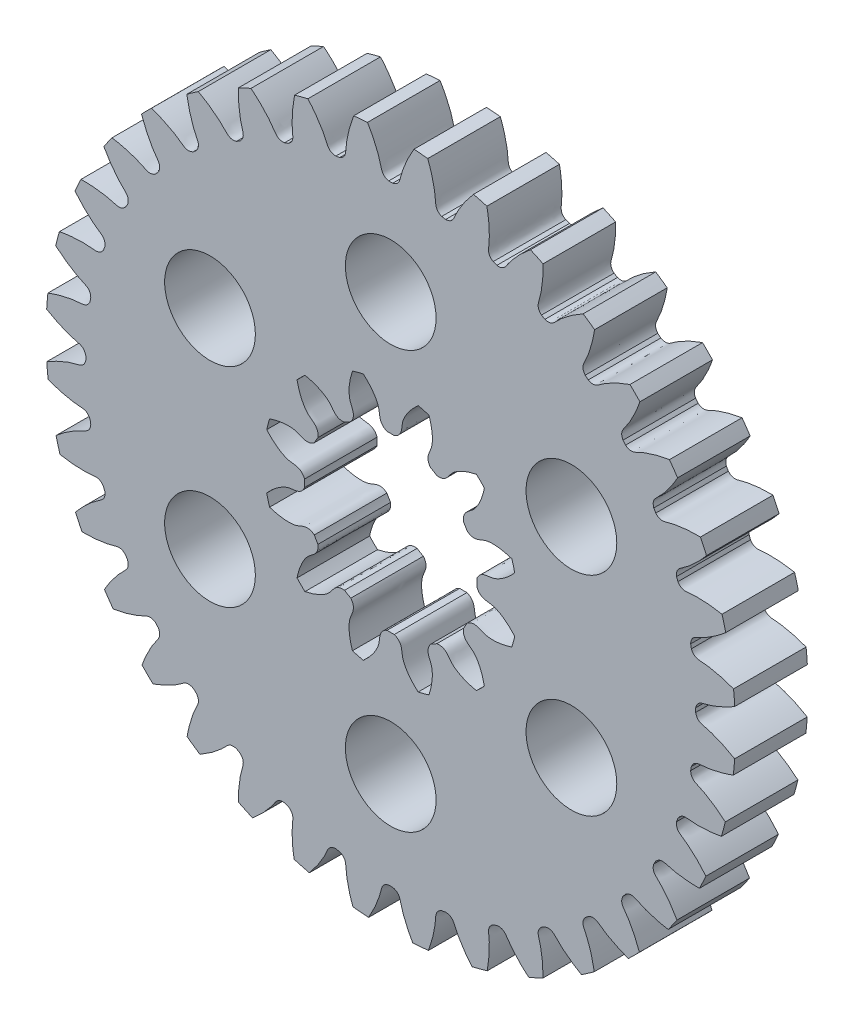
from build123d import *

# Parameters (mm, degrees)
SKETCH_1_R      = 2.5
EXTRUDE_1_DEPTH = 4


with BuildPart() as part:
    # 草图1 → 凸台-拉伸1 (new body)
    with BuildSketch(Plane.XY):
        with BuildLine():
            ThreePointArc((-261.765948352, -219.387318903), (-261.874210715, -219.406042582), (-261.982347935, -219.425475988))
            add(Edge.make_bspline(
                [(-261.982347935, -219.425475988), (-262.350990677, -219.408468774), (-262.42813317, -219.149706563), (-262.551765447, -218.883005482), (-262.588533375, -218.807284577), (-262.645775139, -218.695309688), (-262.729776471, -218.54276764), (-262.848292752, -218.346505921), (-262.989442171, -218.132528242), (-263.154809572, -217.902368775), (-263.332787518, -217.674435865), (-263.458064125, -217.525385086), (-263.517844577, -217.456499109)],
                knots=[0, 0, 0, 0, 0.120371484, 0.133302531, 0.147363917, 0.16255564, 0.196330101, 0.234625915, 0.277443082, 0.324781601, 0.376641473, 0.422355164, 0.422355164, 0.422355164, 0.422355164], degree=3))
            ThreePointArc((-263.517844577, -217.456499109), (-263.887514071, -217.551880751), (-264.255192484, -217.654670714))
            add(Edge.make_bspline(
                [(-264.600360766, -220.126970498), (-264.289610394, -219.927920447), (-264.352184141, -219.665254553), (-264.378465988, -219.372468503), (-264.384484482, -219.288508311), (-264.390899104, -219.162914331), (-264.39442284, -218.988808376), (-264.38991559, -218.759582601), (-264.374665447, -218.503697786), (-264.34653281, -218.22169014), (-264.306395676, -217.935518192), (-264.272473431, -217.74400839), (-264.255192484, -217.654670714)],
                knots=[0, 0, 0, 0, 0.120371484, 0.133302531, 0.147363917, 0.16255564, 0.196330101, 0.234625915, 0.277443082, 0.324781601, 0.376641473, 0.422247529, 0.422247529, 0.422247529, 0.422247529], degree=3))
            ThreePointArc((-264.600360766, -220.126970498), (-264.703727048, -220.164209284), (-264.806846845, -220.202125284))
            add(Edge.make_bspline(
                [(-264.806846845, -220.202125284), (-265.172842347, -220.249390588), (-265.293746459, -220.00795521), (-265.461812641, -219.766774438), (-265.511170778, -219.698588587), (-265.586987146, -219.598254776), (-265.696200959, -219.462616862), (-265.846997201, -219.289916936), (-266.023159077, -219.103700398), (-266.225980947, -218.905753319), (-266.439969032, -218.712969057), (-266.588303961, -218.58865378), (-266.65821002, -218.53190108)],
                knots=[0, 0, 0, 0, 0.120371484, 0.133302531, 0.147363917, 0.16255564, 0.196330101, 0.234625915, 0.277443082, 0.324781601, 0.376641473, 0.421771001, 0.421771001, 0.421771001, 0.421771001], degree=3))
            ThreePointArc((-266.65821002, -218.53190108), (-267.007105465, -218.690849751), (-267.352722655, -218.856805977))
            add(Edge.make_bspline(
                [(-267.263272935, -221.347575673), (-266.991808238, -221.097588404), (-267.099042803, -220.849778812), (-267.175767134, -220.566004635), (-267.196273727, -220.484365088), (-267.224400063, -220.36179305), (-267.258103448, -220.190944046), (-267.293469311, -219.96441805), (-267.322884783, -219.70977254), (-267.344149658, -219.427164043), (-267.354269692, -219.139672291), (-267.354165644, -218.946485167), (-267.352722655, -218.856805977)],
                knots=[0, 0, 0, 0, 0.120371484, 0.133302531, 0.147363917, 0.16255564, 0.196330101, 0.234625915, 0.277443082, 0.324781601, 0.376641473, 0.421594522, 0.421594522, 0.421594522, 0.421594522], degree=3))
            ThreePointArc((-267.263272935, -221.347575673), (-267.358602404, -221.402198085), (-267.453571535, -221.457444621))
            add(Edge.make_bspline(
                [(-267.453571535, -221.457444621), (-267.805799209, -221.567546311), (-267.966791329, -221.350773657), (-268.17418481, -221.142441349), (-268.234633435, -221.083862345), (-268.326720766, -220.998218204), (-268.457828651, -220.883605715), (-268.636322987, -220.739714981), (-268.842144731, -220.58691768), (-269.076258431, -220.427197509), (-269.318997214, -220.275422958), (-269.485127188, -220.179570299), (-269.562280178, -220.13661733)],
                knots=[0, 0, 0, 0, 0.120371484, 0.133302531, 0.147363917, 0.16255564, 0.196330101, 0.234625915, 0.277443082, 0.324781601, 0.376641473, 0.420899304, 0.420899304, 0.420899304, 0.420899304], degree=3))
            ThreePointArc((-269.562280178, -220.13661733), (-269.880139706, -220.355196294), (-270.193496095, -220.580183442))
            add(Edge.make_bspline(
                [(-269.673773621, -223.012046959), (-269.449842916, -222.718718208), (-269.598480031, -222.493294487), (-269.723315616, -222.227154518), (-269.757687226, -222.150316192), (-269.806670671, -222.034490385), (-269.869529644, -221.872089493), (-269.943694046, -221.655146153), (-270.016881361, -221.409477224), (-270.086897625, -221.134854792), (-270.146397398, -220.855315278), (-270.179582973, -220.666897328), (-270.193496095, -220.580183442)],
                knots=[0, 0, 0, 0, 0.120371484, 0.133302531, 0.147363917, 0.16255564, 0.196330101, 0.234625915, 0.277443082, 0.324781601, 0.376641473, 0.420658365, 0.420658365, 0.420658365, 0.420658365], degree=3))
            ThreePointArc((-269.673773621, -223.012046959), (-269.758169739, -223.082393322), (-269.842102615, -223.153291756))
            add(Edge.make_bspline(
                [(-269.842102615, -223.153291756), (-270.169860201, -223.322884447), (-270.366048665, -223.137361045), (-270.606467899, -222.968207273), (-270.676170311, -222.921015009), (-270.781730577, -222.852662792), (-270.930748889, -222.76255817), (-271.131517858, -222.651848676), (-271.360745681, -222.537113279), (-271.619037784, -222.420473035), (-271.882349489, -222.314002425), (-272.060448787, -222.249152344), (-272.141731615, -222.220924943)],
                knots=[0, 0, 0, 0, 0.120371484, 0.133302531, 0.147363917, 0.16255564, 0.196330101, 0.234625915, 0.277443082, 0.324781601, 0.376641473, 0.419767084, 0.419767084, 0.419767084, 0.419767084], degree=3))
            ThreePointArc((-272.141731615, -222.220924943), (-272.418884432, -222.493592174), (-272.690399964, -222.771873362))
            add(Edge.make_bspline(
                [(-271.758620979, -225.069810237), (-271.589028288, -224.74205265), (-271.774551689, -224.545864186), (-271.943705462, -224.305444953), (-271.990897726, -224.235742541), (-272.059249942, -224.130182275), (-272.149354565, -223.981163963), (-272.260064059, -223.780394993), (-272.374799455, -223.551167171), (-272.4914397, -223.292875068), (-272.59768643, -223.030117038), (-272.662351669, -222.852586298), (-272.690399964, -222.771873362)],
                knots=[0, 0, 0, 0, 0.120371484, 0.133302531, 0.147363917, 0.16255564, 0.196330101, 0.234625915, 0.277443082, 0.324781601, 0.376641473, 0.419467813, 0.419467813, 0.419467813, 0.419467813], degree=3))
            ThreePointArc((-271.758620979, -225.069810237), (-271.829519412, -225.153743113), (-271.899865776, -225.238139231))
            add(Edge.make_bspline(
                [(-271.899865776, -225.238139231), (-272.193194526, -225.462069936), (-272.418618247, -225.313432821), (-272.684758217, -225.188597236), (-272.761596543, -225.154225625), (-272.877422349, -225.10524218), (-273.039823242, -225.042383208), (-273.256766581, -224.968218806), (-273.50243551, -224.895031491), (-273.777057942, -224.825015227), (-274.052207447, -224.766449864), (-274.236176243, -224.733890621), (-274.318438603, -224.720559875)],
                knots=[0, 0, 0, 0, 0.120371484, 0.133302531, 0.147363917, 0.16255564, 0.196330101, 0.234625915, 0.277443082, 0.324781601, 0.376641473, 0.418409251, 0.418409251, 0.418409251, 0.418409251], degree=3))
            ThreePointArc((-274.318438603, -224.720559875), (-274.546050295, -225.040201895), (-274.767012342, -225.364476282))
            add(Edge.make_bspline(
                [(-273.454467978, -227.458341411), (-273.344366288, -227.106113737), (-273.561138942, -226.945121618), (-273.76947125, -226.737728137), (-273.828050255, -226.677279512), (-273.913694395, -226.585192181), (-274.028306884, -226.454084295), (-274.172197618, -226.27558996), (-274.324994919, -226.069768216), (-274.48471509, -225.835654516), (-274.633485149, -225.597720931), (-274.726673112, -225.436599256), (-274.767012342, -225.364476282)],
                knots=[0, 0, 0, 0, 0.120371484, 0.133302531, 0.147363917, 0.16255564, 0.196330101, 0.234625915, 0.277443082, 0.324781601, 0.376641473, 0.418059479, 0.418059479, 0.418059479, 0.418059479], degree=3))
            ThreePointArc((-273.454467978, -227.458341411), (-273.509714514, -227.553310542), (-273.564336926, -227.648640011))
            add(Edge.make_bspline(
                [(-273.564336926, -227.648640011), (-273.814324195, -227.920104709), (-274.062133787, -227.812870144), (-274.345907964, -227.736145813), (-274.427547511, -227.715639219), (-274.550119549, -227.687512883), (-274.720968553, -227.653809499), (-274.947494549, -227.618443636), (-275.202140059, -227.589028163), (-275.484748556, -227.567763288), (-275.762812848, -227.557975112), (-275.94656256, -227.557753873), (-276.026815335, -227.558781498)],
                knots=[0, 0, 0, 0, 0.120371484, 0.133302531, 0.147363917, 0.16255564, 0.196330101, 0.234625915, 0.277443082, 0.324781601, 0.376641473, 0.416867492, 0.416867492, 0.416867492, 0.416867492], degree=3))
            ThreePointArc((-276.026815335, -227.558781498), (-276.197157445, -227.916787157), (-276.359992523, -228.278269138))
            add(Edge.make_bspline(
                [(-274.709787165, -230.105066171), (-274.662521861, -229.739070669), (-274.903957239, -229.618166558), (-275.145138011, -229.450100376), (-275.213323863, -229.400742239), (-275.313657673, -229.32492587), (-275.449295587, -229.215712058), (-275.621995513, -229.064915816), (-275.808212051, -228.88875394), (-276.00615913, -228.685932069), (-276.191871553, -228.479793636), (-276.309671012, -228.339789451), (-276.359992523, -228.278269138)],
                knots=[0, 0, 0, 0, 0.120371484, 0.133302531, 0.147363917, 0.16255564, 0.196330101, 0.234625915, 0.277443082, 0.324781601, 0.376641473, 0.416476669, 0.416476669, 0.416476669, 0.416476669], degree=3))
            ThreePointArc((-274.709787165, -230.105066171), (-274.747703165, -230.208185968), (-274.784941952, -230.311552251))
            add(Edge.make_bspline(
                [(-274.784941952, -230.311552251), (-274.983992002, -230.622302623), (-275.246657896, -230.559728876), (-275.539443946, -230.533447028), (-275.623404138, -230.527428535), (-275.748998118, -230.521013912), (-275.923104073, -230.517490176), (-276.152329848, -230.521997427), (-276.408214664, -230.53724757), (-276.690222309, -230.565380207), (-276.962444646, -230.603560833), (-277.140159746, -230.634562871), (-277.215741141, -230.648798355)],
                knots=[0, 0, 0, 0, 0.120371484, 0.133302531, 0.147363917, 0.16255564, 0.196330101, 0.234625915, 0.277443082, 0.324781601, 0.376641473, 0.415188955, 0.415188955, 0.415188955, 0.415188955], degree=3))
            ThreePointArc((-277.215741141, -230.648798355), (-277.322476069, -231.03518804), (-277.421035671, -231.423743491))
            add(Edge.make_bspline(
                [(-275.486436301, -232.929565124), (-275.503443515, -232.560922382), (-275.762205726, -232.48377989), (-276.028906807, -232.360147612), (-276.104627712, -232.323379685), (-276.216602601, -232.266137921), (-276.369144649, -232.182136588), (-276.565406368, -232.063620307), (-276.779384047, -231.922470888), (-277.009543514, -231.757103487), (-277.225542548, -231.588443926), (-277.363320485, -231.473298186), (-277.421035671, -231.423743491)],
                knots=[0, 0, 0, 0, 0.120371484, 0.133302531, 0.147363917, 0.16255564, 0.196330101, 0.234625915, 0.277443082, 0.324781601, 0.376641473, 0.414768007, 0.414768007, 0.414768007, 0.414768007], degree=3))
            ThreePointArc((-275.486436301, -232.929565124), (-275.505869707, -233.037702344), (-275.524593386, -233.145964708))
            add(Edge.make_bspline(
                [(-275.524593386, -233.145964708), (-275.666658183, -233.486558762), (-275.93619941, -233.470547105), (-276.229101177, -233.495506302), (-276.312830925, -233.504158777), (-276.437630738, -233.519650773), (-276.609703523, -233.546413752), (-276.834664167, -233.590657165), (-277.084013358, -233.650109556), (-277.356851492, -233.726784909), (-277.614959564, -233.810569409), (-277.781318921, -233.870653679), (-277.850018611, -233.896470418)],
                knots=[0, 0, 0, 0, 0.120371484, 0.133302531, 0.147363917, 0.16255564, 0.196330101, 0.234625915, 0.277443082, 0.324781601, 0.376641473, 0.413424779, 0.413424779, 0.413424779, 0.413424779], degree=3))
            ThreePointArc((-277.850018611, -233.896470418), (-277.888484318, -234.300092941), (-277.918328637, -234.704444358))
            add(Edge.make_bspline(
                [(-275.760817296, -235.846017298), (-275.841580272, -235.48592834), (-276.109806957, -235.454891401), (-276.393924769, -235.379449533), (-276.474879987, -235.35638899), (-276.595093654, -235.319461092), (-276.759904924, -235.263224577), (-276.973765123, -235.180589315), (-277.209002339, -235.078741107), (-277.464380915, -234.95585278), (-277.703245273, -234.82893213), (-277.855898098, -234.741333561), (-277.918328637, -234.704444358)],
                knots=[0, 0, 0, 0, 0.120371484, 0.133302531, 0.147363917, 0.16255564, 0.196330101, 0.234625915, 0.277443082, 0.324781601, 0.376641473, 0.412985889, 0.412985889, 0.412985889, 0.412985889], degree=3))
            ThreePointArc((-275.760817296, -235.846017298), (-275.761177634, -235.955886246), (-275.760817296, -236.065755195))
            add(Edge.make_bspline(
                [(-275.760817296, -236.065755195), (-275.841580272, -236.425844153), (-276.109806957, -236.456881092), (-276.393924769, -236.53232296), (-276.474879987, -236.555383503), (-276.595093654, -236.592311401), (-276.759904924, -236.648547916), (-276.973765123, -236.731183178), (-277.209002339, -236.833031386), (-277.464380915, -236.955919713), (-277.700853214, -237.081569343), (-277.851199122, -237.167744084), (-277.911331835, -237.203198329)],
                knots=[0, 0, 0, 0, 0.120371484, 0.133302531, 0.147363917, 0.16255564, 0.196330101, 0.234625915, 0.277443082, 0.324781601, 0.376641473, 0.411628523, 0.411628523, 0.411628523, 0.411628523], degree=3))
            ThreePointArc((-277.911331835, -237.203198329), (-277.878805779, -237.612002071), (-277.837464201, -238.020008588))
            add(Edge.make_bspline(
                [(-275.524593221, -238.765807771), (-275.666658018, -238.425213716), (-275.936199245, -238.441225374), (-276.229101012, -238.416266177), (-276.31283076, -238.407613702), (-276.437630573, -238.392121706), (-276.609703358, -238.365358727), (-276.834664002, -238.321115313), (-277.084013193, -238.261662922), (-277.356851327, -238.18498757), (-277.61070774, -238.102583201), (-277.772910012, -238.044151787), (-277.837464201, -238.020008588)],
                knots=[0, 0, 0, 0, 0.120371484, 0.133302531, 0.147363917, 0.16255564, 0.196330101, 0.234625915, 0.277443082, 0.324781601, 0.376641473, 0.411184834, 0.411184834, 0.411184834, 0.411184834], degree=3))
            ThreePointArc((-275.524593221, -238.765807771), (-275.505869542, -238.874070135), (-275.486436136, -238.982207355))
            add(Edge.make_bspline(
                [(-275.486436136, -238.982207355), (-275.50344335, -239.350850096), (-275.762205561, -239.427992589), (-276.028906642, -239.551624867), (-276.104627547, -239.588392794), (-276.216602436, -239.645634558), (-276.369144484, -239.729635891), (-276.565406203, -239.848152171), (-276.779383883, -239.98930159), (-277.009543349, -240.154668991), (-277.217813983, -240.317293949), (-277.348263104, -240.425913846), (-277.39868889, -240.468908747)],
                knots=[0, 0, 0, 0, 0.120371484, 0.133302531, 0.147363917, 0.16255564, 0.196330101, 0.234625915, 0.277443082, 0.324781601, 0.376641473, 0.40985455, 0.40985455, 0.40985455, 0.40985455], degree=3))
            ThreePointArc((-277.39868889, -240.468908747), (-277.294607855, -240.870286372), (-277.181792531, -241.269297102))
            add(Edge.make_bspline(
                [(-274.784941627, -241.600220185), (-274.983991677, -241.289469813), (-275.246657572, -241.35204356), (-275.539443622, -241.378325407), (-275.623403813, -241.384343901), (-275.748997793, -241.390758523), (-275.923103749, -241.394282259), (-276.152329523, -241.389775009), (-276.408214339, -241.374524866), (-276.690221984, -241.346392229), (-276.951042904, -241.309810712), (-277.117474501, -241.281141829), (-277.181792531, -241.269297102)],
                knots=[0, 0, 0, 0, 0.120371484, 0.133302531, 0.147363917, 0.16255564, 0.196330101, 0.234625915, 0.277443082, 0.324781601, 0.376641473, 0.409419781, 0.409419781, 0.409419781, 0.409419781], degree=3))
            ThreePointArc((-274.784941627, -241.600220185), (-274.74770284, -241.703586468), (-274.70978684, -241.806706265))
            add(Edge.make_bspline(
                [(-274.70978684, -241.806706265), (-274.662521536, -242.172701767), (-274.903956914, -242.293605878), (-275.145137687, -242.46167206), (-275.213323538, -242.511030197), (-275.313657348, -242.586846566), (-275.449295262, -242.696060378), (-275.621995188, -242.84685662), (-275.808211726, -243.023018496), (-276.006158806, -243.225840366), (-276.180757523, -243.419642728), (-276.288254138, -243.546609089), (-276.328348522, -243.595046607)],
                knots=[0, 0, 0, 0, 0.120371484, 0.133302531, 0.147363917, 0.16255564, 0.196330101, 0.234625915, 0.277443082, 0.324781601, 0.376641473, 0.408156395, 0.408156395, 0.408156395, 0.408156395], degree=3))
            ThreePointArc((-276.328348522, -243.595046607), (-276.154460937, -243.976244639), (-275.972210015, -244.353515674))
            add(Edge.make_bspline(
                [(-273.564336451, -244.263132354), (-273.81432372, -243.991667657), (-274.062133312, -244.098902222), (-274.345907489, -244.175626553), (-274.427547036, -244.196133147), (-274.550119074, -244.224259482), (-274.720968079, -244.257962867), (-274.947494075, -244.29332873), (-275.202139584, -244.322744203), (-275.484748081, -244.344009078), (-275.744617519, -244.353156774), (-275.910154434, -244.353913085), (-275.972210015, -244.353515674)],
                knots=[0, 0, 0, 0, 0.120371484, 0.133302531, 0.147363917, 0.16255564, 0.196330101, 0.234625915, 0.277443082, 0.324781601, 0.376641473, 0.407744397, 0.407744397, 0.407744397, 0.407744397], degree=3))
            ThreePointArc((-273.564336451, -244.263132354), (-273.509714039, -244.358461823), (-273.454467503, -244.453430955))
            add(Edge.make_bspline(
                [(-273.454467503, -244.453430955), (-273.344365813, -244.805658629), (-273.561138467, -244.966650748), (-273.769470776, -245.174044229), (-273.82804978, -245.234492854), (-273.91369392, -245.326580185), (-274.028306409, -245.45768807), (-274.172197143, -245.636182406), (-274.324994445, -245.84200415), (-274.484714615, -246.07611785), (-274.621345043, -246.294636063), (-274.703662759, -246.435583427), (-274.733245316, -246.48748927)],
                knots=[0, 0, 0, 0, 0.120371484, 0.133302531, 0.147363917, 0.16255564, 0.196330101, 0.234625915, 0.277443082, 0.324781601, 0.376641473, 0.406585186, 0.406585186, 0.406585186, 0.406585186], degree=3))
            ThreePointArc((-274.733245316, -246.48748927), (-274.493675386, -246.836066093), (-274.246405516, -247.179223731))
            add(Edge.make_bspline(
                [(-271.899865166, -246.67363304), (-272.193193916, -246.449702335), (-272.418617637, -246.59833945), (-272.684757606, -246.723175035), (-272.761595933, -246.757546646), (-272.877421739, -246.80653009), (-273.039822632, -246.869389063), (-273.256765971, -246.943553465), (-273.5024349, -247.01674078), (-273.777057332, -247.086757044), (-274.028394229, -247.140253912), (-274.188253805, -247.169288669), (-274.246405516, -247.179223731)],
                knots=[0, 0, 0, 0, 0.120371484, 0.133302531, 0.147363917, 0.16255564, 0.196330101, 0.234625915, 0.277443082, 0.324781601, 0.376641473, 0.406209439, 0.406209439, 0.406209439, 0.406209439], degree=3))
            ThreePointArc((-271.899865166, -246.67363304), (-271.829518802, -246.758029158), (-271.758620369, -246.841962034))
            add(Edge.make_bspline(
                [(-271.758620369, -246.841962034), (-271.589027677, -247.169719621), (-271.774551079, -247.365908084), (-271.943704852, -247.606327318), (-271.990897116, -247.67602973), (-272.059249332, -247.781589996), (-272.149353954, -247.930608308), (-272.260063448, -248.131377278), (-272.374798845, -248.3606051), (-272.49143909, -248.618897203), (-272.587003398, -248.855236613), (-272.642706076, -249.005692866), (-272.661940165, -249.059303546)],
                knots=[0, 0, 0, 0, 0.120371484, 0.133302531, 0.147363917, 0.16255564, 0.196330101, 0.234625915, 0.277443082, 0.324781601, 0.376641473, 0.405188146, 0.405188146, 0.405188146, 0.405188146], degree=3))
            ThreePointArc((-272.661940165, -249.059303546), (-272.363148325, -249.363612829), (-272.057601646, -249.661139182))
            add(Edge.make_bspline(
                [(-269.842101888, -248.758480398), (-270.169859474, -248.588887707), (-270.366047938, -248.774411109), (-270.606467171, -248.943564881), (-270.676169583, -248.990757145), (-270.78172985, -249.059109361), (-270.930748162, -249.149213984), (-271.131517131, -249.259923478), (-271.360744953, -249.374658874), (-271.619037057, -249.491299119), (-271.854771649, -249.586618869), (-272.004609313, -249.642113084), (-272.057601646, -249.661139182)],
                knots=[0, 0, 0, 0, 0.120371484, 0.133302531, 0.147363917, 0.16255564, 0.196330101, 0.234625915, 0.277443082, 0.324781601, 0.376641473, 0.404861233, 0.404861233, 0.404861233, 0.404861233], degree=3))
            ThreePointArc((-269.842101888, -248.758480398), (-269.758169011, -248.829378831), (-269.673772893, -248.899725195))
            add(Edge.make_bspline(
                [(-269.673772893, -248.899725195), (-269.449842188, -249.193053946), (-269.598479304, -249.418477666), (-269.723314889, -249.684617636), (-269.757686499, -249.761455962), (-269.806669944, -249.877281769), (-269.869528916, -250.039682661), (-269.943693319, -250.256626001), (-270.016880633, -250.50229493), (-270.086896897, -250.776917362), (-270.139478826, -251.023955787), (-270.167854513, -251.179467686), (-270.177133565, -251.233273862)],
                knots=[0, 0, 0, 0, 0.120371484, 0.133302531, 0.147363917, 0.16255564, 0.196330101, 0.234625915, 0.277443082, 0.324781601, 0.376641473, 0.404007217, 0.404007217, 0.404007217, 0.404007217], degree=3))
            ThreePointArc((-270.177133565, -251.233273862), (-269.827764939, -251.482945837), (-269.472843157, -251.724658603))
            add(Edge.make_bspline(
                [(-267.453570713, -250.454327397), (-267.805798387, -250.344225707), (-267.966790507, -250.560998361), (-268.174183988, -250.769330669), (-268.234632613, -250.827909674), (-268.326719943, -250.913553814), (-268.457827829, -251.028166303), (-268.636322165, -251.172057037), (-268.842143909, -251.324854339), (-269.076257609, -251.484574509), (-269.289962087, -251.618195077), (-269.425922801, -251.697792002), (-269.472843157, -251.724658603)],
                knots=[0, 0, 0, 0, 0.120371484, 0.133302531, 0.147363917, 0.16255564, 0.196330101, 0.234625915, 0.277443082, 0.324781601, 0.376641473, 0.403740302, 0.403740302, 0.403740302, 0.403740302], degree=3))
            ThreePointArc((-267.453570713, -250.454327397), (-267.358601582, -250.509573933), (-267.263272113, -250.564196345))
            add(Edge.make_bspline(
                [(-267.263272113, -250.564196345), (-266.991807416, -250.814183614), (-267.099041981, -251.061993206), (-267.175766312, -251.345767383), (-267.196272905, -251.42740693), (-267.224399241, -251.549978968), (-267.258102625, -251.720827973), (-267.293468488, -251.947353969), (-267.322883961, -252.201999478), (-267.344148836, -252.484607975), (-267.352968865, -252.735170609), (-267.353951698, -252.89139213), (-267.353788209, -252.944138017)],
                knots=[0, 0, 0, 0, 0.120371484, 0.133302531, 0.147363917, 0.16255564, 0.196330101, 0.234625915, 0.277443082, 0.324781601, 0.376641473, 0.403077851, 0.403077851, 0.403077851, 0.403077851], degree=3))
            ThreePointArc((-267.353788209, -252.944138017), (-266.964409077, -253.130528853), (-266.570895808, -253.308025217))
            add(Edge.make_bspline(
                [(-264.806845953, -251.709646584), (-265.172841455, -251.66238128), (-265.293745566, -251.903816658), (-265.461811748, -252.144997431), (-265.511169886, -252.213183282), (-265.586986254, -252.313517092), (-265.696200067, -252.449155006), (-265.846996308, -252.621854932), (-266.023158185, -252.80807147), (-266.225980055, -253.006018549), (-266.411959715, -253.173569617), (-266.530692623, -253.274492964), (-266.570895808, -253.308025217)],
                knots=[0, 0, 0, 0, 0.120371484, 0.133302531, 0.147363917, 0.16255564, 0.196330101, 0.234625915, 0.277443082, 0.324781601, 0.376641473, 0.402880193, 0.402880193, 0.402880193, 0.402880193], degree=3))
            ThreePointArc((-264.806845953, -251.709646584), (-264.703726156, -251.747562584), (-264.600359874, -251.784801371))
            add(Edge.make_bspline(
                [(-264.600359874, -251.784801371), (-264.289609501, -251.983851421), (-264.352183249, -252.246517316), (-264.378465096, -252.539303366), (-264.384483589, -252.623263557), (-264.390898212, -252.748857537), (-264.394421948, -252.922963493), (-264.389914698, -253.152189267), (-264.374664555, -253.408074083), (-264.346531918, -253.690081728), (-264.311888305, -253.937085026), (-264.285982477, -254.089831352), (-264.276914753, -254.140475489)],
                knots=[0, 0, 0, 0, 0.120371484, 0.133302531, 0.147363917, 0.16255564, 0.196330101, 0.234625915, 0.277443082, 0.324781601, 0.376641473, 0.402427979, 0.402427979, 0.402427979, 0.402427979], degree=3))
            ThreePointArc((-264.276914753, -254.140475489), (-263.859645703, -254.257055525), (-263.439826985, -254.364091069))
            add(Edge.make_bspline(
                [(-261.982347, -252.48629572), (-262.350989742, -252.503302934), (-262.428132235, -252.762065145), (-262.551764512, -253.028766226), (-262.58853244, -253.104487132), (-262.645774204, -253.21646202), (-262.729775536, -253.369004069), (-262.848291817, -253.565265787), (-262.989441236, -253.779243467), (-263.154808637, -254.009402933), (-263.308163364, -254.205801208), (-263.406811681, -254.324948203), (-263.439826985, -254.364091069)],
                knots=[0, 0, 0, 0, 0.120371484, 0.133302531, 0.147363917, 0.16255564, 0.196330101, 0.234625915, 0.277443082, 0.324781601, 0.376641473, 0.402306517, 0.402306517, 0.402306517, 0.402306517], degree=3))
            ThreePointArc((-261.982347, -252.48629572), (-261.87420978, -252.505729126), (-261.765947417, -252.524452805))
            add(Edge.make_bspline(
                [(-261.765947417, -252.524452805), (-261.425353362, -252.666517602), (-261.44136502, -252.936058829), (-261.416405823, -253.228960596), (-261.407753347, -253.312690344), (-261.392261352, -253.437490157), (-261.365498372, -253.609562942), (-261.321254959, -253.834523586), (-261.261802568, -254.083872777), (-261.185127216, -254.356710911), (-261.108334356, -254.593280062), (-261.05655194, -254.73855462), (-261.039080706, -254.786202093)],
                knots=[0, 0, 0, 0, 0.120371484, 0.133302531, 0.147363917, 0.16255564, 0.196330101, 0.234625915, 0.277443082, 0.324781601, 0.376641473, 0.402077201, 0.402077201, 0.402077201, 0.402077201], degree=3))
            ThreePointArc((-261.039080706, -254.786202093), (-260.607143338, -254.828856803), (-260.174344328, -254.861633796))
            add(Edge.make_bspline(
                [(-259.065894826, -252.760676715), (-259.425983784, -252.841439692), (-259.457020723, -253.109666376), (-259.532462592, -253.393784188), (-259.555523135, -253.474739407), (-259.592451032, -253.594953073), (-259.648687547, -253.759764343), (-259.731322809, -253.973624542), (-259.833171017, -254.208861759), (-259.956059344, -254.464240334), (-260.07272699, -254.683808331), (-260.14890694, -254.817813992), (-260.174344328, -254.861633796)],
                knots=[0, 0, 0, 0, 0.120371484, 0.133302531, 0.147363917, 0.16255564, 0.196330101, 0.234625915, 0.277443082, 0.324781601, 0.376641473, 0.402036233, 0.402036233, 0.402036233, 0.402036233], degree=3))
            ThreePointArc((-259.065894826, -252.760676715), (-258.956025878, -252.761037053), (-258.84615693, -252.760676715))
            add(Edge.make_bspline(
                [(-258.84615693, -252.760676715), (-258.486067971, -252.841439692), (-258.455031033, -253.109666376), (-258.379589164, -253.393784188), (-258.356528621, -253.474739407), (-258.319600724, -253.594953073), (-258.263364209, -253.759764343), (-258.180728946, -253.973624542), (-258.078880738, -254.208861759), (-257.955992412, -254.464240334), (-257.839324787, -254.683808291), (-257.763144861, -254.817813913), (-257.737707496, -254.861633679)],
                knots=[0, 0, 0, 0, 0.120371484, 0.133302531, 0.147363917, 0.16255564, 0.196330101, 0.234625915, 0.277443082, 0.324781601, 0.376641473, 0.402036211, 0.402036211, 0.402036211, 0.402036211], degree=3))
            ThreePointArc((-257.737707496, -254.861633679), (-257.304908451, -254.82885664), (-256.872971048, -254.786201883))
            add(Edge.make_bspline(
                [(-256.146104354, -252.524452641), (-256.486698408, -252.666517438), (-256.470686751, -252.936058664), (-256.495645948, -253.228960431), (-256.504298423, -253.312690179), (-256.519790419, -253.437489992), (-256.546553398, -253.609562777), (-256.590796811, -253.834523421), (-256.650249202, -254.083872612), (-256.726924554, -254.356710746), (-256.803717409, -254.593279882), (-256.855499819, -254.738554425), (-256.872971048, -254.786201883)],
                knots=[0, 0, 0, 0, 0.120371484, 0.133302531, 0.147363917, 0.16255564, 0.196330101, 0.234625915, 0.277443082, 0.324781601, 0.376641473, 0.402077193, 0.402077193, 0.402077193, 0.402077193], degree=3))
            ThreePointArc((-256.146104354, -252.524452641), (-256.03784199, -252.505728961), (-255.92970477, -252.486295555))
            add(Edge.make_bspline(
                [(-255.92970477, -252.486295555), (-255.561062028, -252.503302769), (-255.483919535, -252.76206498), (-255.360287258, -253.028766061), (-255.32351933, -253.104486967), (-255.266277566, -253.216461855), (-255.182276234, -253.369003904), (-255.063759953, -253.565265623), (-254.922610534, -253.779243302), (-254.757243133, -254.009402768), (-254.603888472, -254.20580096), (-254.505240225, -254.324947875), (-254.472224991, -254.364090662)],
                knots=[0, 0, 0, 0, 0.120371484, 0.133302531, 0.147363917, 0.16255564, 0.196330101, 0.234625915, 0.277443082, 0.324781601, 0.376641473, 0.402306464, 0.402306464, 0.402306464, 0.402306464], degree=3))
            ThreePointArc((-254.472224991, -254.364090662), (-254.05240617, -254.257055049), (-253.63513702, -254.14047494))
            add(Edge.make_bspline(
                [(-253.311691939, -251.784801046), (-253.622442312, -251.983851096), (-253.559868564, -252.246516991), (-253.533586717, -252.539303041), (-253.527568224, -252.623263232), (-253.521153601, -252.748857213), (-253.517629865, -252.922963168), (-253.522137115, -253.152188943), (-253.537387258, -253.408073758), (-253.565519895, -253.690081404), (-253.600163497, -253.937084626), (-253.62606931, -254.089830878), (-253.63513702, -254.14047494)],
                knots=[0, 0, 0, 0, 0.120371484, 0.133302531, 0.147363917, 0.16255564, 0.196330101, 0.234625915, 0.277443082, 0.324781601, 0.376641473, 0.402427941, 0.402427941, 0.402427941, 0.402427941], degree=3))
            ThreePointArc((-253.311691939, -251.784801046), (-253.208325657, -251.747562259), (-253.10520586, -251.709646259))
            add(Edge.make_bspline(
                [(-253.10520586, -251.709646259), (-252.739210358, -251.662380955), (-252.618306247, -251.903816333), (-252.450240065, -252.144997106), (-252.400881927, -252.213182957), (-252.325065559, -252.313516768), (-252.215851746, -252.449154681), (-252.065055505, -252.621854607), (-251.888893628, -252.808071145), (-251.686071758, -253.006018225), (-251.50009222, -253.173569182), (-251.381359441, -253.274492427), (-251.341156384, -253.308024576)],
                knots=[0, 0, 0, 0, 0.120371484, 0.133302531, 0.147363917, 0.16255564, 0.196330101, 0.234625915, 0.277443082, 0.324781601, 0.376641473, 0.402880111, 0.402880111, 0.402880111, 0.402880111], degree=3))
            ThreePointArc((-251.341156384, -253.308024576), (-250.947642958, -253.130528099), (-250.558263672, -252.944137144))
            add(Edge.make_bspline(
                [(-250.64877977, -250.564195871), (-250.920244467, -250.814183139), (-250.813009902, -251.061992731), (-250.736285571, -251.345766909), (-250.715778978, -251.427406456), (-250.687652642, -251.549978494), (-250.653949257, -251.720827498), (-250.618583395, -251.947353494), (-250.589167922, -252.201999004), (-250.567903047, -252.4846075), (-250.559083023, -252.735170001), (-250.558100187, -252.89139139), (-250.558263672, -252.944137144)],
                knots=[0, 0, 0, 0, 0.120371484, 0.133302531, 0.147363917, 0.16255564, 0.196330101, 0.234625915, 0.277443082, 0.324781601, 0.376641473, 0.403077784, 0.403077784, 0.403077784, 0.403077784], degree=3))
            ThreePointArc((-250.64877977, -250.564195871), (-250.553450301, -250.509573458), (-250.45848117, -250.454326922))
            add(Edge.make_bspline(
                [(-250.45848117, -250.454326922), (-250.106253496, -250.344225233), (-249.945261376, -250.560997886), (-249.737867895, -250.769330195), (-249.67741927, -250.827909199), (-249.58533194, -250.913553339), (-249.454224054, -251.028165829), (-249.275729718, -251.172056562), (-249.069907974, -251.324853864), (-248.835794274, -251.484574034), (-248.622089981, -251.618194486), (-248.486129459, -251.697791307), (-248.439209294, -251.724657803)],
                knots=[0, 0, 0, 0, 0.120371484, 0.133302531, 0.147363917, 0.16255564, 0.196330101, 0.234625915, 0.277443082, 0.324781601, 0.376641473, 0.403740192, 0.403740192, 0.403740192, 0.403740192], degree=3))
            ThreePointArc((-248.439209294, -251.724657803), (-248.084287319, -251.482944863), (-247.734918507, -251.233272704))
            add(Edge.make_bspline(
                [(-248.238279084, -248.899724585), (-248.462209789, -249.193053335), (-248.313572674, -249.418477056), (-248.188737089, -249.684617026), (-248.154365479, -249.761455352), (-248.105382034, -249.877281158), (-248.042523061, -250.039682051), (-247.968358659, -250.25662539), (-247.895171345, -250.502294319), (-247.82515508, -250.776916751), (-247.77257319, -251.023954996), (-247.744197531, -251.179466712), (-247.734918507, -251.233272704)],
                knots=[0, 0, 0, 0, 0.120371484, 0.133302531, 0.147363917, 0.16255564, 0.196330101, 0.234625915, 0.277443082, 0.324781601, 0.376641473, 0.404007124, 0.404007124, 0.404007124, 0.404007124], degree=3))
            ThreePointArc((-248.238279084, -248.899724585), (-248.153882967, -248.829378221), (-248.06995009, -248.758479788))
            add(Edge.make_bspline(
                [(-248.06995009, -248.758479788), (-247.742192504, -248.588887096), (-247.54600404, -248.774410498), (-247.305584806, -248.943564271), (-247.235882394, -248.990756535), (-247.130322128, -249.059108751), (-246.981303816, -249.149213374), (-246.780534847, -249.259922868), (-246.551307025, -249.374658264), (-246.293014921, -249.491298509), (-246.057280576, -249.586618159), (-245.907443164, -249.642112289), (-245.854451084, -249.661138302)],
                knots=[0, 0, 0, 0, 0.120371484, 0.133302531, 0.147363917, 0.16255564, 0.196330101, 0.234625915, 0.277443082, 0.324781601, 0.376641473, 0.404861099, 0.404861099, 0.404861099, 0.404861099], degree=3))
            ThreePointArc((-245.854451084, -249.661138302), (-245.548904199, -249.363611703), (-245.250112164, -249.059302165))
            add(Edge.make_bspline(
                [(-246.153431726, -246.841961307), (-246.323024418, -247.169718893), (-246.137501016, -247.365907357), (-245.968347243, -247.606326591), (-245.921154979, -247.676029003), (-245.852802763, -247.781589269), (-245.76269814, -247.930607581), (-245.651988646, -248.13137655), (-245.53725325, -248.360604372), (-245.420613005, -248.618896476), (-245.325048783, -248.855235671), (-245.26934618, -249.005691705), (-245.250112164, -249.059302165)],
                knots=[0, 0, 0, 0, 0.120371484, 0.133302531, 0.147363917, 0.16255564, 0.196330101, 0.234625915, 0.277443082, 0.324781601, 0.376641473, 0.40518803, 0.40518803, 0.40518803, 0.40518803], degree=3))
            ThreePointArc((-246.153431726, -246.841961307), (-246.082533293, -246.75802843), (-246.012186929, -246.673632313))
            add(Edge.make_bspline(
                [(-246.012186929, -246.673632313), (-245.718858179, -246.449701608), (-245.493434458, -246.598338723), (-245.227294488, -246.723174308), (-245.150456162, -246.757545918), (-245.034630356, -246.806529363), (-244.872229463, -246.869388336), (-244.655286124, -246.943552738), (-244.409617195, -247.016740052), (-244.134994763, -247.086756317), (-243.883658166, -247.14025312), (-243.723798895, -247.169287832), (-243.665647487, -247.179222849)],
                knots=[0, 0, 0, 0, 0.120371484, 0.133302531, 0.147363917, 0.16255564, 0.196330101, 0.234625915, 0.277443082, 0.324781601, 0.376641473, 0.406209285, 0.406209285, 0.406209285, 0.406209285], degree=3))
            ThreePointArc((-243.665647487, -247.179222849), (-243.418377424, -246.836064894), (-243.178807315, -246.487487745))
            add(Edge.make_bspline(
                [(-244.457584727, -244.453430132), (-244.567686417, -244.805657806), (-244.350913763, -244.966649926), (-244.142581455, -245.174043407), (-244.084002451, -245.234492032), (-243.99835831, -245.326579363), (-243.883745821, -245.457687248), (-243.739855087, -245.636181584), (-243.587057786, -245.842003328), (-243.427337615, -246.076117028), (-243.29070733, -246.294635012), (-243.208389743, -246.435582139), (-243.178807315, -246.487487745)],
                knots=[0, 0, 0, 0, 0.120371484, 0.133302531, 0.147363917, 0.16255564, 0.196330101, 0.234625915, 0.277443082, 0.324781601, 0.376641473, 0.406585051, 0.406585051, 0.406585051, 0.406585051], degree=3))
            ThreePointArc((-244.457584727, -244.453430132), (-244.402338191, -244.358461001), (-244.347715779, -244.263131532))
            add(Edge.make_bspline(
                [(-244.347715779, -244.263131532), (-244.09772851, -243.991666835), (-243.849918918, -244.0989014), (-243.566144741, -244.175625731), (-243.484505194, -244.196132324), (-243.361933156, -244.22425866), (-243.191084152, -244.257962045), (-242.964558156, -244.293327908), (-242.709912646, -244.32274338), (-242.427304149, -244.344008255), (-242.167435051, -244.35315594), (-242.001898476, -244.353912259), (-241.939843235, -244.353514858)],
                knots=[0, 0, 0, 0, 0.120371484, 0.133302531, 0.147363917, 0.16255564, 0.196330101, 0.234625915, 0.277443082, 0.324781601, 0.376641473, 0.407744227, 0.407744227, 0.407744227, 0.407744227], degree=3))
            ThreePointArc((-241.939843235, -244.353514858), (-241.757592156, -243.976243443), (-241.583704431, -243.595045023))
            add(Edge.make_bspline(
                [(-243.20226554, -241.806705372), (-243.249530844, -242.172700874), (-243.008095466, -242.293604986), (-242.766914694, -242.461671168), (-242.698728843, -242.511029305), (-242.598395032, -242.586845673), (-242.462757119, -242.696059486), (-242.290057192, -242.846855728), (-242.103840654, -243.023017604), (-241.905893575, -243.225839474), (-241.731295058, -243.419641614), (-241.62379863, -243.54660774), (-241.583704431, -243.595045023)],
                knots=[0, 0, 0, 0, 0.120371484, 0.133302531, 0.147363917, 0.16255564, 0.196330101, 0.234625915, 0.277443082, 0.324781601, 0.376641473, 0.408156245, 0.408156245, 0.408156245, 0.408156245], degree=3))
            ThreePointArc((-243.20226554, -241.806705372), (-243.16434954, -241.703585575), (-243.127110754, -241.600219293))
            add(Edge.make_bspline(
                [(-243.127110754, -241.600219293), (-242.928060703, -241.289468921), (-242.665394809, -241.352042668), (-242.372608759, -241.378324515), (-242.288648567, -241.384343009), (-242.163054587, -241.390757631), (-241.988948632, -241.394281367), (-241.759722857, -241.389774117), (-241.503838042, -241.374523974), (-241.221830396, -241.346391337), (-240.961009835, -241.30980987), (-240.794578594, -241.28114106), (-240.730260919, -241.269296407)],
                knots=[0, 0, 0, 0, 0.120371484, 0.133302531, 0.147363917, 0.16255564, 0.196330101, 0.234625915, 0.277443082, 0.324781601, 0.376641473, 0.4094196, 0.4094196, 0.4094196, 0.4094196], degree=3))
            ThreePointArc((-240.730260919, -241.269296407), (-240.617445495, -240.870285249), (-240.513364379, -240.468907191))
            add(Edge.make_bspline(
                [(-242.425616404, -238.98220642), (-242.40860919, -239.350849161), (-242.149846979, -239.427991654), (-241.883145898, -239.551623932), (-241.807424993, -239.588391859), (-241.695450104, -239.645633623), (-241.542908056, -239.729634956), (-241.346646337, -239.848151236), (-241.132668658, -239.989300655), (-240.902509191, -240.154668056), (-240.694238809, -240.317292817), (-240.563789927, -240.425912503), (-240.513364379, -240.468907191)],
                knots=[0, 0, 0, 0, 0.120371484, 0.133302531, 0.147363917, 0.16255564, 0.196330101, 0.234625915, 0.277443082, 0.324781601, 0.376641473, 0.40985439, 0.40985439, 0.40985439, 0.40985439], degree=3))
            ThreePointArc((-242.425616404, -238.98220642), (-242.406182998, -238.8740692), (-242.387459319, -238.765806836))
            add(Edge.make_bspline(
                [(-242.387459319, -238.765806836), (-242.245394522, -238.425212781), (-241.975853295, -238.441224439), (-241.682951529, -238.416265242), (-241.599221781, -238.407612767), (-241.474421968, -238.392120771), (-241.302349183, -238.365357792), (-241.077388538, -238.321114378), (-240.828039348, -238.261661987), (-240.555201213, -238.184986635), (-240.301345157, -238.102582382), (-240.139143234, -238.044151106), (-240.074589393, -238.020008047)],
                knots=[0, 0, 0, 0, 0.120371484, 0.133302531, 0.147363917, 0.16255564, 0.196330101, 0.234625915, 0.277443082, 0.324781601, 0.376641473, 0.411184646, 0.411184646, 0.411184646, 0.411184646], degree=3))
            ThreePointArc((-240.074589393, -238.020008047), (-240.033247785, -237.612001076), (-240.00072172, -237.203196879))
            add(Edge.make_bspline(
                [(-242.151235409, -236.065754245), (-242.070472433, -236.425843204), (-241.802245748, -236.456880142), (-241.518127936, -236.532322011), (-241.437172718, -236.555382554), (-241.316959051, -236.592310451), (-241.152147781, -236.648546966), (-240.938287582, -236.731182229), (-240.703050366, -236.833030437), (-240.447671791, -236.955918763), (-240.211199781, -237.081568239), (-240.060854153, -237.167742807), (-240.00072172, -237.203196879)],
                knots=[0, 0, 0, 0, 0.120371484, 0.133302531, 0.147363917, 0.16255564, 0.196330101, 0.234625915, 0.277443082, 0.324781601, 0.376641473, 0.411628359, 0.411628359, 0.411628359, 0.411628359], degree=3))
            ThreePointArc((-242.151235409, -236.065754245), (-242.150875072, -235.955885297), (-242.151235409, -235.846016349))
            add(Edge.make_bspline(
                [(-242.151235409, -235.846016349), (-242.070472433, -235.48592739), (-241.802245748, -235.454890452), (-241.518127936, -235.379448583), (-241.437172718, -235.35638804), (-241.316959051, -235.319460143), (-241.152147781, -235.263223628), (-240.938287582, -235.180588366), (-240.703050366, -235.078740157), (-240.447671791, -234.955851831), (-240.208807765, -234.828931357), (-240.056155261, -234.741332986), (-239.993725041, -234.704443983)],
                knots=[0, 0, 0, 0, 0.120371484, 0.133302531, 0.147363917, 0.16255564, 0.196330101, 0.234625915, 0.277443082, 0.324781601, 0.376641473, 0.4129857, 0.4129857, 0.4129857, 0.4129857], degree=3))
            ThreePointArc((-239.993725041, -234.704443983), (-240.023569407, -234.300092112), (-240.062035179, -233.896469137))
            add(Edge.make_bspline(
                [(-242.387459484, -233.145963773), (-242.245394687, -233.486557827), (-241.97585346, -233.47054617), (-241.682951693, -233.495505367), (-241.599221945, -233.504157842), (-241.474422132, -233.519649838), (-241.302349348, -233.546412817), (-241.077388703, -233.59065623), (-240.828039513, -233.650108621), (-240.555201378, -233.726783974), (-240.297093618, -233.810568373), (-240.130734566, -233.870652521), (-240.062035179, -233.896469137)],
                knots=[0, 0, 0, 0, 0.120371484, 0.133302531, 0.147363917, 0.16255564, 0.196330101, 0.234625915, 0.277443082, 0.324781601, 0.376641473, 0.413424615, 0.413424615, 0.413424615, 0.413424615], degree=3))
            ThreePointArc((-242.387459484, -233.145963773), (-242.406183163, -233.037701409), (-242.425616569, -232.929564189))
            add(Edge.make_bspline(
                [(-242.425616569, -232.929564189), (-242.408609355, -232.560921447), (-242.149847144, -232.483778955), (-241.883146063, -232.360146677), (-241.807425158, -232.32337875), (-241.695450269, -232.266136986), (-241.542908221, -232.182135653), (-241.346646502, -232.063619372), (-241.132668823, -231.922469953), (-240.902509356, -231.757102552), (-240.686510612, -231.588443218), (-240.54873295, -231.473297722), (-240.491018036, -231.423743275)],
                knots=[0, 0, 0, 0, 0.120371484, 0.133302531, 0.147363917, 0.16255564, 0.196330101, 0.234625915, 0.277443082, 0.324781601, 0.376641473, 0.414767823, 0.414767823, 0.414767823, 0.414767823], degree=3))
            ThreePointArc((-240.491018036, -231.423743275), (-240.589577757, -231.035187395), (-240.696312821, -230.648797287))
            add(Edge.make_bspline(
                [(-243.127111078, -230.311551359), (-242.928061028, -230.622301731), (-242.665395134, -230.559727984), (-242.372609084, -230.533446136), (-242.288648892, -230.527427643), (-242.163054912, -230.52101302), (-241.988948957, -230.517489284), (-241.759723182, -230.521996535), (-241.503838366, -230.537246678), (-241.221830721, -230.565379314), (-240.949608697, -230.603559897), (-240.771893906, -230.63456187), (-240.696312821, -230.648797287)],
                knots=[0, 0, 0, 0, 0.120371484, 0.133302531, 0.147363917, 0.16255564, 0.196330101, 0.234625915, 0.277443082, 0.324781601, 0.376641473, 0.415188797, 0.415188797, 0.415188797, 0.415188797], degree=3))
            ThreePointArc((-243.127111078, -230.311551359), (-243.164349865, -230.208185076), (-243.202265865, -230.105065279))
            add(Edge.make_bspline(
                [(-243.202265865, -230.105065279), (-243.249531169, -229.739069777), (-243.008095791, -229.618165666), (-242.766915019, -229.450099484), (-242.698729167, -229.400741346), (-242.598395357, -229.324924978), (-242.462757443, -229.215711166), (-242.290057517, -229.064914924), (-242.103840979, -228.888753048), (-241.9058939, -228.685931177), (-241.72018171, -228.479793003), (-241.602382466, -228.339789091), (-241.552061168, -228.278269055)],
                knots=[0, 0, 0, 0, 0.120371484, 0.133302531, 0.147363917, 0.16255564, 0.196330101, 0.234625915, 0.277443082, 0.324781601, 0.376641473, 0.416476495, 0.416476495, 0.416476495, 0.416476495], degree=3))
            ThreePointArc((-241.552061168, -228.278269055), (-241.714896424, -227.916786694), (-241.885238727, -227.558780665))
            add(Edge.make_bspline(
                [(-244.347716254, -227.648639189), (-244.097728985, -227.920103887), (-243.849919393, -227.812869321), (-243.566145216, -227.73614499), (-243.484505669, -227.715638397), (-243.361933631, -227.687512061), (-243.191084627, -227.653808677), (-242.964558631, -227.618442814), (-242.709913121, -227.589027341), (-242.427304624, -227.567762466), (-242.149240625, -227.5579743), (-241.965491208, -227.557753052), (-241.885238727, -227.558780665)],
                knots=[0, 0, 0, 0, 0.120371484, 0.133302531, 0.147363917, 0.16255564, 0.196330101, 0.234625915, 0.277443082, 0.324781601, 0.376641473, 0.416867345, 0.416867345, 0.416867345, 0.416867345], degree=3))
            ThreePointArc((-244.347716254, -227.648639189), (-244.402338666, -227.55330972), (-244.457585202, -227.458340589))
            add(Edge.make_bspline(
                [(-244.457585202, -227.458340589), (-244.567686892, -227.106112915), (-244.350914238, -226.945120795), (-244.14258193, -226.737727315), (-244.084002925, -226.67727869), (-243.998358785, -226.585191359), (-243.883746296, -226.454083473), (-243.739855562, -226.275589138), (-243.58705826, -226.069767394), (-243.42733809, -225.835653693), (-243.2785682, -225.597720379), (-243.185380387, -225.436598986), (-243.145041304, -225.364476294)],
                knots=[0, 0, 0, 0, 0.120371484, 0.133302531, 0.147363917, 0.16255564, 0.196330101, 0.234625915, 0.277443082, 0.324781601, 0.376641473, 0.418059319, 0.418059319, 0.418059319, 0.418059319], degree=3))
            ThreePointArc((-243.145041304, -225.364476294), (-243.366003568, -225.040201596), (-243.59361549, -224.720559273))
            add(Edge.make_bspline(
                [(-246.012187539, -225.238138504), (-245.718858789, -225.462069209), (-245.493435068, -225.313432093), (-245.227295099, -225.188596509), (-245.150456772, -225.154224898), (-245.034630966, -225.105241453), (-244.872230073, -225.042382481), (-244.655286734, -224.968218078), (-244.409617805, -224.895030764), (-244.134995373, -224.8250145), (-243.859846125, -224.766449191), (-243.675877589, -224.733889985), (-243.59361549, -224.720559273)],
                knots=[0, 0, 0, 0, 0.120371484, 0.133302531, 0.147363917, 0.16255564, 0.196330101, 0.234625915, 0.277443082, 0.324781601, 0.376641473, 0.418409119, 0.418409119, 0.418409119, 0.418409119], degree=3))
            ThreePointArc((-246.012187539, -225.238138504), (-246.082533903, -225.153742386), (-246.153432336, -225.069809509))
            add(Edge.make_bspline(
                [(-246.153432336, -225.069809509), (-246.323025028, -224.742051923), (-246.137501626, -224.545863459), (-245.968347854, -224.305444226), (-245.92115559, -224.235741814), (-245.852803373, -224.130181547), (-245.762698751, -223.981163235), (-245.651989257, -223.780394266), (-245.53725386, -223.551166444), (-245.420613616, -223.29287434), (-245.31436699, -223.03011657), (-245.249701838, -222.852586097), (-245.221653627, -222.771873428)],
                knots=[0, 0, 0, 0, 0.120371484, 0.133302531, 0.147363917, 0.16255564, 0.196330101, 0.234625915, 0.277443082, 0.324781601, 0.376641473, 0.419467673, 0.419467673, 0.419467673, 0.419467673], degree=3))
            ThreePointArc((-245.221653627, -222.771873428), (-245.493169389, -222.493592006), (-245.770322447, -222.220924551))
            add(Edge.make_bspline(
                [(-248.069950817, -223.153291145), (-247.742193231, -223.322883837), (-247.546004767, -223.137360435), (-247.305585534, -222.968206662), (-247.235883122, -222.921014398), (-247.130322856, -222.852662182), (-246.981304543, -222.76255756), (-246.780535574, -222.651848066), (-246.551307752, -222.537112669), (-246.293015648, -222.420472424), (-246.029704149, -222.314001898), (-245.851605063, -222.249151886), (-245.770322447, -222.220924551)],
                knots=[0, 0, 0, 0, 0.120371484, 0.133302531, 0.147363917, 0.16255564, 0.196330101, 0.234625915, 0.277443082, 0.324781601, 0.376641473, 0.419766972, 0.419766972, 0.419766972, 0.419766972], degree=3))
            ThreePointArc((-248.069950817, -223.153291145), (-248.153883694, -223.082392712), (-248.238279812, -223.012046348))
            add(Edge.make_bspline(
                [(-248.238279812, -223.012046348), (-248.462210517, -222.718717598), (-248.313573401, -222.493293877), (-248.188737817, -222.227153908), (-248.154366206, -222.150315581), (-248.105382761, -222.034489775), (-248.042523789, -221.872088882), (-247.968359386, -221.655145543), (-247.895172072, -221.409476614), (-247.825155808, -221.134854182), (-247.765656083, -220.855314896), (-247.732470541, -220.666897178), (-247.718557448, -220.580183523)],
                knots=[0, 0, 0, 0, 0.120371484, 0.133302531, 0.147363917, 0.16255564, 0.196330101, 0.234625915, 0.277443082, 0.324781601, 0.376641473, 0.420658248, 0.420658248, 0.420658248, 0.420658248], degree=3))
            ThreePointArc((-247.718557448, -220.580183523), (-248.031914054, -220.35519622), (-248.349773805, -220.136617109))
            add(Edge.make_bspline(
                [(-250.458481992, -221.457444146), (-250.106254318, -221.567545836), (-249.945262198, -221.350773182), (-249.737868718, -221.142440874), (-249.677420093, -221.08386187), (-249.585332762, -220.998217729), (-249.454224876, -220.88360524), (-249.275730541, -220.739714506), (-249.069908797, -220.586917205), (-248.835795096, -220.427197035), (-248.593056461, -220.275422575), (-248.42692664, -220.179569998), (-248.349773805, -220.136617109)],
                knots=[0, 0, 0, 0, 0.120371484, 0.133302531, 0.147363917, 0.16255564, 0.196330101, 0.234625915, 0.277443082, 0.324781601, 0.376641473, 0.420899216, 0.420899216, 0.420899216, 0.420899216], degree=3))
            ThreePointArc((-250.458481992, -221.457444146), (-250.553451123, -221.402197611), (-250.648780592, -221.347575198))
            add(Edge.make_bspline(
                [(-250.648780592, -221.347575198), (-250.92024529, -221.09758793), (-250.813010724, -220.849778337), (-250.736286393, -220.56600416), (-250.7157798, -220.484364613), (-250.687653464, -220.361792575), (-250.65395008, -220.190943571), (-250.618584217, -219.964417575), (-250.589168744, -219.709772065), (-250.567903869, -219.427163568), (-250.557783842, -219.139671996), (-250.557887883, -218.946485054), (-250.559330863, -218.856806044)],
                knots=[0, 0, 0, 0, 0.120371484, 0.133302531, 0.147363917, 0.16255564, 0.196330101, 0.234625915, 0.277443082, 0.324781601, 0.376641473, 0.421594431, 0.421594431, 0.421594431, 0.421594431], degree=3))
            ThreePointArc((-250.559330863, -218.856806044), (-250.904948231, -218.690849731), (-251.253843856, -218.531900982))
            add(Edge.make_bspline(
                [(-253.105206752, -220.20212496), (-252.73921125, -220.249390264), (-252.618307139, -220.007954885), (-252.450240957, -219.766774113), (-252.400882819, -219.698588262), (-252.325066451, -219.598254451), (-252.215852639, -219.462616538), (-252.065056397, -219.289916612), (-251.88889452, -219.103700073), (-251.68607265, -218.905752994), (-251.472084654, -218.712968813), (-251.32374982, -218.588653609), (-251.253843856, -218.531900982)],
                knots=[0, 0, 0, 0, 0.120371484, 0.133302531, 0.147363917, 0.16255564, 0.196330101, 0.234625915, 0.277443082, 0.324781601, 0.376641473, 0.421770941, 0.421770941, 0.421770941, 0.421770941], degree=3))
            ThreePointArc((-253.105206752, -220.20212496), (-253.208326549, -220.164208959), (-253.311692832, -220.126970173))
            add(Edge.make_bspline(
                [(-253.311692832, -220.126970173), (-253.622443204, -219.927920123), (-253.559869457, -219.665254228), (-253.533587609, -219.372468178), (-253.527569116, -219.288507987), (-253.521154493, -219.162914006), (-253.517630757, -218.988808051), (-253.522138008, -218.759582276), (-253.537388151, -218.503697461), (-253.565520787, -218.221689815), (-253.605657904, -217.935517989), (-253.639580123, -217.744008307), (-253.656861043, -217.654670751)],
                knots=[0, 0, 0, 0, 0.120371484, 0.133302531, 0.147363917, 0.16255564, 0.196330101, 0.234625915, 0.277443082, 0.324781601, 0.376641473, 0.422247467, 0.422247467, 0.422247467, 0.422247467], degree=3))
            ThreePointArc((-253.656861043, -217.654670751), (-254.024539572, -217.551880754), (-254.394209183, -217.456499083))
            add(Edge.make_bspline(
                [(-255.929705705, -219.425475823), (-255.561062963, -219.408468609), (-255.48392047, -219.149706398), (-255.360288193, -218.883005318), (-255.323520265, -218.807284412), (-255.266278501, -218.695309523), (-255.182277169, -218.542767475), (-255.063760888, -218.346505756), (-254.922611469, -218.132528077), (-254.757244068, -217.90236861), (-254.579266159, -217.674435749), (-254.453989594, -217.525385015), (-254.394209183, -217.456499083)],
                knots=[0, 0, 0, 0, 0.120371484, 0.133302531, 0.147363917, 0.16255564, 0.196330101, 0.234625915, 0.277443082, 0.324781601, 0.376641473, 0.422355133, 0.422355133, 0.422355133, 0.422355133], degree=3))
            ThreePointArc((-255.929705705, -219.425475823), (-256.037842925, -219.406042417), (-256.146105289, -219.387318738))
            add(Edge.make_bspline(
                [(-256.146105289, -219.387318738), (-256.486699343, -219.245253941), (-256.470687686, -218.975712715), (-256.495646883, -218.682810948), (-256.504299358, -218.5990812), (-256.519791354, -218.474281387), (-256.546554333, -218.302208602), (-256.590797746, -218.077247958), (-256.650250137, -217.827898767), (-256.726925489, -217.555060632), (-256.816361643, -217.279541973), (-256.883286919, -217.096184607), (-256.916088935, -217.01056103)],
                knots=[0, 0, 0, 0, 0.120371484, 0.133302531, 0.147363917, 0.16255564, 0.196330101, 0.234625915, 0.277443082, 0.324781601, 0.376641473, 0.422597375, 0.422597375, 0.422597375, 0.422597375], degree=3))
            ThreePointArc((-256.916088935, -217.01056103), (-257.2952311, -216.973458999), (-257.675040921, -216.943965908))
            add(Edge.make_bspline(
                [(-258.846157879, -219.151094829), (-258.486068921, -219.070331852), (-258.455031982, -218.802105167), (-258.379590113, -218.517987355), (-258.356529571, -218.437032137), (-258.319601673, -218.31681847), (-258.263365158, -218.1520072), (-258.180729896, -217.938147002), (-258.078881688, -217.702909785), (-257.955993361, -217.44753121), (-257.820038742, -217.191664944), (-257.722252097, -217.022653399), (-257.675040921, -216.943965908)],
                knots=[0, 0, 0, 0, 0.120371484, 0.133302531, 0.147363917, 0.16255564, 0.196330101, 0.234625915, 0.277443082, 0.324781601, 0.376641473, 0.422633566, 0.422633566, 0.422633566, 0.422633566], degree=3))
            ThreePointArc((-258.846157879, -219.151094829), (-258.956026827, -219.150734491), (-259.065895775, -219.151094829))
            add(Edge.make_bspline(
                [(-259.065895775, -219.151094829), (-259.425984734, -219.070331852), (-259.457021672, -218.802105167), (-259.532463541, -218.517987355), (-259.555524084, -218.437032137), (-259.592451982, -218.31681847), (-259.648688497, -218.1520072), (-259.731323759, -217.938147002), (-259.833171967, -217.702909785), (-259.956060293, -217.44753121), (-260.092014913, -217.191664944), (-260.189801557, -217.022653399), (-260.237012734, -216.943965908)],
                knots=[0, 0, 0, 0, 0.120371484, 0.133302531, 0.147363917, 0.16255564, 0.196330101, 0.234625915, 0.277443082, 0.324781601, 0.376641473, 0.422633566, 0.422633566, 0.422633566, 0.422633566], degree=3))
            ThreePointArc((-260.237012734, -216.943965908), (-260.616822514, -216.973458995), (-260.995964639, -217.010561021))
            add(Edge.make_bspline(
                [(-261.765948352, -219.387318903), (-261.425354297, -219.245254106), (-261.441365955, -218.97571288), (-261.416406758, -218.682811113), (-261.407754282, -218.599081365), (-261.392262287, -218.474281552), (-261.365499307, -218.302208767), (-261.321255894, -218.077248122), (-261.261803503, -217.827898932), (-261.185128151, -217.555060797), (-261.095691978, -217.279542079), (-261.028766679, -217.096184656), (-260.995964639, -217.010561021)],
                knots=[0, 0, 0, 0, 0.120371484, 0.133302531, 0.147363917, 0.16255564, 0.196330101, 0.234625915, 0.277443082, 0.324781601, 0.376641473, 0.422597406, 0.422597406, 0.422597406, 0.422597406], degree=3))
        make_face()
        with Locations((-258.956026827, -224.400734491)):
            Circle(SKETCH_1_R, mode=Mode.SUBTRACT)
        with Locations((-268.915318971, -230.150734491)):
            Circle(SKETCH_1_R, mode=Mode.SUBTRACT)
        with Locations((-268.915318971, -241.650734491)):
            Circle(SKETCH_1_R, mode=Mode.SUBTRACT)
        with Locations((-258.956026827, -247.400734491)):
            Circle(SKETCH_1_R, mode=Mode.SUBTRACT)
        with Locations((-248.996734684, -241.650734491)):
            Circle(SKETCH_1_R, mode=Mode.SUBTRACT)
        with Locations((-248.996734684, -230.150734491)):
            Circle(SKETCH_1_R, mode=Mode.SUBTRACT)
        with BuildLine():
            ThreePointArc((-260.468758937, -229.066142947), (-260.767760143, -229.139253707), (-261.063258163, -229.225438535))
            add(Edge.make_bspline(
                [(-261.154970251, -231.690372533), (-260.841100103, -231.274114062), (-261.131014145, -230.984798994), (-261.217051403, -230.627749369), (-261.225099208, -230.589103868), (-261.234021571, -230.535707058), (-261.2419469, -230.473046407), (-261.24814589, -230.401130316), (-261.251889997, -230.32001106), (-261.252452368, -230.229784333), (-261.249110514, -230.130589274), (-261.241148541, -230.022608218), (-261.227859467, -229.906066385), (-261.204926512, -229.757824869), (-261.167094661, -229.57518239), (-261.116778831, -229.389120537), (-261.078851937, -229.27117549), (-261.063258163, -229.225438535)],
                knots=[0, 0, 0, 0, 0.218015236, 0.222043642, 0.231522246, 0.24289657, 0.256166614, 0.271332379, 0.288393865, 0.307351072, 0.328203999, 0.350952646, 0.375597015, 0.402137104, 0.445501713, 0.493131694, 0.523595567, 0.523595567, 0.523595567, 0.523595567], degree=3))
            ThreePointArc((-261.154970251, -231.690372533), (-261.331026827, -231.787113823), (-261.50283553, -231.891212645))
            add(Edge.make_bspline(
                [(-263.683387035, -230.738170645), (-263.610536867, -230.752560301), (-263.489650352, -230.779823192), (-263.32532175, -230.825341849), (-263.192141791, -230.868030143), (-263.069248678, -230.912909124), (-262.956591035, -230.959229339), (-262.854074179, -231.006249463), (-262.761560747, -231.053238586), (-262.678871396, -231.099478424), (-262.605785613, -231.144265498), (-262.542042632, -231.186913269), (-262.487342459, -231.226754218), (-262.441346962, -231.263141847), (-262.408531677, -231.291291135), (-262.386332088, -231.31157587), (-262.125858193, -231.559172473), (-262.020261014, -231.954902931), (-261.50283553, -231.891212645)],
                knots=[0.476404433, 0.476404433, 0.476404433, 0.476404433, 0.523218896, 0.554498287, 0.583881957, 0.611369906, 0.636962134, 0.660658643, 0.68245943, 0.702364497, 0.720373843, 0.736487468, 0.750705373, 0.763027557, 0.773454021, 0.777956358, 0.781984764, 1, 1, 1, 1], degree=3))
            ThreePointArc((-263.683387035, -230.738170645), (-263.905774296, -230.950987022), (-264.118590673, -231.173374283))
            add(Edge.make_bspline(
                [(-262.965548673, -233.353925788), (-262.901858387, -232.836500304), (-263.297588845, -232.730903126), (-263.550624109, -232.464707709), (-263.576916463, -232.435263626), (-263.611341862, -232.393481813), (-263.649535723, -232.343178763), (-263.690862252, -232.283997096), (-263.734664371, -232.215617813), (-263.780264762, -232.137760361), (-263.826968162, -232.050183993), (-263.874063418, -231.952688669), (-263.920825659, -231.845115944), (-263.975085896, -231.705268548), (-264.033643791, -231.528179595), (-264.083099931, -231.34188739), (-264.109226801, -231.220780535), (-264.118590673, -231.173374283)],
                knots=[0, 0, 0, 0, 0.218015236, 0.222043642, 0.231522246, 0.24289657, 0.256166614, 0.271332379, 0.288393865, 0.307351072, 0.328203999, 0.350952646, 0.375597015, 0.402137104, 0.445501713, 0.493131694, 0.523595567, 0.523595567, 0.523595567, 0.523595567], degree=3))
            ThreePointArc((-262.965548673, -233.353925788), (-263.069647495, -233.525734491), (-263.166388786, -233.701791067))
            add(Edge.make_bspline(
                [(-265.631322783, -233.793503155), (-265.561037859, -233.76953988), (-265.44271562, -233.732706978), (-265.277643548, -233.68996299), (-265.140962173, -233.660342158), (-265.012094125, -233.637761939), (-264.891369637, -233.6215476), (-264.779077373, -233.611009794), (-264.675463829, -233.605446853), (-264.580732832, -233.604147051), (-264.49504515, -233.606390903), (-264.418518224, -233.611453466), (-264.35122601, -233.618606654), (-264.293198926, -233.627121516), (-264.250705412, -233.635091872), (-264.221337636, -233.641559174), (-263.871962324, -233.725747174), (-263.582647256, -234.015661215), (-263.166388786, -233.701791067)],
                knots=[0.476404433, 0.476404433, 0.476404433, 0.476404433, 0.523218896, 0.554498287, 0.583881957, 0.611369906, 0.636962134, 0.660658643, 0.68245943, 0.702364497, 0.720373843, 0.736487468, 0.750705373, 0.763027557, 0.773454021, 0.777956358, 0.781984764, 1, 1, 1, 1], degree=3))
            ThreePointArc((-265.631322783, -233.793503155), (-265.717507611, -234.089001175), (-265.790618371, -234.388002381))
            add(Edge.make_bspline(
                [(-263.701778954, -235.699894378), (-263.90533429, -235.219945622), (-264.30084551, -235.326361012), (-264.653078184, -235.222346651), (-264.690570072, -235.209993504), (-264.741274248, -235.191022092), (-264.799502628, -235.166555303), (-264.864883285, -235.13596574), (-264.937006675, -235.098648604), (-265.015426498, -235.054022268), (-265.099661013, -235.001530608), (-265.189194363, -234.940644809), (-265.283478014, -234.870865217), (-265.400392455, -234.776883938), (-265.539649557, -234.652799354), (-265.675625933, -234.516193641), (-265.758805893, -234.424375463), (-265.790618371, -234.388002381)],
                knots=[0, 0, 0, 0, 0.218015236, 0.222043642, 0.231522246, 0.24289657, 0.256166614, 0.271332379, 0.288393865, 0.307351072, 0.328203999, 0.350952646, 0.375597015, 0.402137104, 0.445501713, 0.493131694, 0.523595567, 0.523595567, 0.523595567, 0.523595567], degree=3))
            ThreePointArc((-263.701778954, -235.699894378), (-263.706026827, -235.900734491), (-263.701778954, -236.101574603))
            add(Edge.make_bspline(
                [(-265.790618371, -237.413466601), (-265.741731478, -237.357571333), (-265.657677865, -237.266511985), (-265.536093251, -237.146958569), (-265.432534124, -237.052965489), (-265.33222123, -236.968976422), (-265.235777926, -236.894572148), (-265.143798876, -236.829300009), (-265.056848385, -236.772675588), (-264.975458836, -236.724184428), (-264.9001292, -236.68328382), (-264.831323657, -236.649404665), (-264.769470297, -236.6219534), (-264.714959937, -236.600313946), (-264.674174296, -236.585969719), (-264.645507405, -236.576886679), (-264.30084551, -236.47510797), (-263.90533429, -236.58152336), (-263.701778954, -236.101574603)],
                knots=[0.476404433, 0.476404433, 0.476404433, 0.476404433, 0.523218896, 0.554498287, 0.583881957, 0.611369906, 0.636962134, 0.660658643, 0.68245943, 0.702364497, 0.720373843, 0.736487468, 0.750705373, 0.763027557, 0.773454021, 0.777956358, 0.781984764, 1, 1, 1, 1], degree=3))
            ThreePointArc((-265.790618371, -237.413466601), (-265.717507611, -237.712467807), (-265.631322783, -238.007965826))
            add(Edge.make_bspline(
                [(-263.166388786, -238.099677915), (-263.582647256, -237.785807767), (-263.871962324, -238.075721808), (-264.229011949, -238.161759066), (-264.26765745, -238.169806871), (-264.321054261, -238.178729235), (-264.383714911, -238.186654563), (-264.455631002, -238.192853554), (-264.536750258, -238.196597661), (-264.626976985, -238.197160032), (-264.726172045, -238.193818178), (-264.8341531, -238.185856204), (-264.950694933, -238.17256713), (-265.098936449, -238.149634176), (-265.281578928, -238.111802325), (-265.467640781, -238.061486495), (-265.585585828, -238.023559601), (-265.631322783, -238.007965826)],
                knots=[0, 0, 0, 0, 0.218015236, 0.222043642, 0.231522246, 0.24289657, 0.256166614, 0.271332379, 0.288393865, 0.307351072, 0.328203999, 0.350952646, 0.375597015, 0.402137104, 0.445501713, 0.493131694, 0.523595567, 0.523595567, 0.523595567, 0.523595567], degree=3))
            ThreePointArc((-263.166388786, -238.099677915), (-263.069647495, -238.275734491), (-262.965548673, -238.447543194))
            add(Edge.make_bspline(
                [(-264.118590673, -240.628094699), (-264.104201017, -240.555244531), (-264.076938126, -240.434358016), (-264.03141947, -240.270029414), (-263.988731175, -240.136849455), (-263.943852194, -240.013956342), (-263.897531979, -239.901298699), (-263.850511855, -239.798781842), (-263.803522732, -239.706268411), (-263.757282894, -239.62357906), (-263.71249582, -239.550493276), (-263.669848049, -239.486750295), (-263.6300071, -239.432050123), (-263.593619471, -239.386054626), (-263.565470183, -239.35323934), (-263.545185448, -239.331039751), (-263.297588845, -239.070565856), (-262.901858387, -238.964968678), (-262.965548673, -238.447543194)],
                knots=[0.476404433, 0.476404433, 0.476404433, 0.476404433, 0.523218896, 0.554498287, 0.583881957, 0.611369906, 0.636962134, 0.660658643, 0.68245943, 0.702364497, 0.720373843, 0.736487468, 0.750705373, 0.763027557, 0.773454021, 0.777956358, 0.781984764, 1, 1, 1, 1], degree=3))
            ThreePointArc((-264.118590673, -240.628094699), (-263.905774296, -240.850481959), (-263.683387035, -241.063298337))
            add(Edge.make_bspline(
                [(-261.50283553, -239.910256336), (-262.020261014, -239.84656605), (-262.125858193, -240.242296509), (-262.392053609, -240.495331772), (-262.421497692, -240.521624127), (-262.463279505, -240.556049525), (-262.513582555, -240.594243386), (-262.572764222, -240.635569915), (-262.641143505, -240.679372035), (-262.719000957, -240.724972426), (-262.806577325, -240.771675826), (-262.904072649, -240.818771082), (-263.011645374, -240.865533323), (-263.15149277, -240.919793559), (-263.328581723, -240.978351455), (-263.514873929, -241.027807594), (-263.635980783, -241.053934464), (-263.683387035, -241.063298337)],
                knots=[0, 0, 0, 0, 0.218015236, 0.222043642, 0.231522246, 0.24289657, 0.256166614, 0.271332379, 0.288393865, 0.307351072, 0.328203999, 0.350952646, 0.375597015, 0.402137104, 0.445501713, 0.493131694, 0.523595567, 0.523595567, 0.523595567, 0.523595567], degree=3))
            ThreePointArc((-261.50283553, -239.910256336), (-261.331026827, -240.014355159), (-261.154970251, -240.111096449))
            add(Edge.make_bspline(
                [(-261.063258163, -242.576030447), (-261.087221439, -242.505745522), (-261.12405434, -242.387423284), (-261.166798328, -242.222351212), (-261.19641916, -242.085669837), (-261.218999379, -241.956801788), (-261.235213718, -241.8360773), (-261.245751524, -241.723785036), (-261.251314466, -241.620171493), (-261.252614267, -241.525440495), (-261.250370415, -241.439752813), (-261.245307852, -241.363225887), (-261.238154665, -241.295933673), (-261.229639802, -241.23790659), (-261.221669446, -241.195413075), (-261.215202145, -241.166045299), (-261.131014145, -240.816669988), (-260.841100103, -240.527354919), (-261.154970251, -240.111096449)],
                knots=[0.476404433, 0.476404433, 0.476404433, 0.476404433, 0.523218896, 0.554498287, 0.583881957, 0.611369906, 0.636962134, 0.660658643, 0.68245943, 0.702364497, 0.720373843, 0.736487468, 0.750705373, 0.763027557, 0.773454021, 0.777956358, 0.781984764, 1, 1, 1, 1], degree=3))
            ThreePointArc((-261.063258163, -242.576030447), (-260.767760143, -242.662215275), (-260.468758937, -242.735326034))
            add(Edge.make_bspline(
                [(-259.15686694, -240.646486618), (-259.636815696, -240.850041954), (-259.530400306, -241.245553173), (-259.634414667, -241.597785847), (-259.646767814, -241.635277736), (-259.665739226, -241.685981912), (-259.690206015, -241.744210291), (-259.720795578, -241.809590948), (-259.758112714, -241.881714338), (-259.80273905, -241.960134161), (-259.85523071, -242.044368676), (-259.916116509, -242.133902026), (-259.985896101, -242.228185677), (-260.079877381, -242.345100119), (-260.203961964, -242.48435722), (-260.340567677, -242.620333596), (-260.432385855, -242.703513557), (-260.468758937, -242.735326034)],
                knots=[0, 0, 0, 0, 0.218015236, 0.222043642, 0.231522246, 0.24289657, 0.256166614, 0.271332379, 0.288393865, 0.307351072, 0.328203999, 0.350952646, 0.375597015, 0.402137104, 0.445501713, 0.493131694, 0.523595567, 0.523595567, 0.523595567, 0.523595567], degree=3))
            ThreePointArc((-259.15686694, -240.646486618), (-258.956026827, -240.650734491), (-258.755186715, -240.646486618))
            add(Edge.make_bspline(
                [(-257.443294717, -242.735326034), (-257.499189985, -242.686439142), (-257.590249333, -242.602385528), (-257.709802749, -242.480800915), (-257.803795829, -242.377241787), (-257.887784896, -242.276928893), (-257.96218917, -242.180485589), (-258.02746131, -242.088506539), (-258.08408573, -242.001556049), (-258.13257689, -241.920166499), (-258.173477498, -241.844836864), (-258.207356653, -241.77603132), (-258.234807918, -241.71417796), (-258.256447372, -241.6596676), (-258.270791599, -241.618881959), (-258.279874639, -241.590215069), (-258.381653348, -241.245553173), (-258.275237958, -240.850041954), (-258.755186715, -240.646486618)],
                knots=[0.476404433, 0.476404433, 0.476404433, 0.476404433, 0.523218896, 0.554498287, 0.583881957, 0.611369906, 0.636962134, 0.660658643, 0.68245943, 0.702364497, 0.720373843, 0.736487468, 0.750705373, 0.763027557, 0.773454021, 0.777956358, 0.781984764, 1, 1, 1, 1], degree=3))
            ThreePointArc((-257.443294717, -242.735326034), (-257.144293512, -242.662215275), (-256.848795492, -242.576030447))
            add(Edge.make_bspline(
                [(-256.757083404, -240.111096449), (-257.070953551, -240.527354919), (-256.78103951, -240.816669988), (-256.695002252, -241.173719612), (-256.686954447, -241.212365113), (-256.678032084, -241.265761924), (-256.670106755, -241.328422574), (-256.663907764, -241.400338666), (-256.660163657, -241.481457922), (-256.659601286, -241.571684648), (-256.66294314, -241.670879708), (-256.670905114, -241.778860763), (-256.684194188, -241.895402597), (-256.707127142, -242.043644113), (-256.744958994, -242.226286592), (-256.795274823, -242.412348444), (-256.833201717, -242.530293492), (-256.848795492, -242.576030447)],
                knots=[0, 0, 0, 0, 0.218015236, 0.222043642, 0.231522246, 0.24289657, 0.256166614, 0.271332379, 0.288393865, 0.307351072, 0.328203999, 0.350952646, 0.375597015, 0.402137104, 0.445501713, 0.493131694, 0.523595567, 0.523595567, 0.523595567, 0.523595567], degree=3))
            ThreePointArc((-256.757083404, -240.111096449), (-256.581026827, -240.014355159), (-256.409218124, -239.910256336))
            add(Edge.make_bspline(
                [(-254.228666619, -241.063298337), (-254.301516787, -241.04890868), (-254.422403303, -241.021645789), (-254.586731905, -240.976127133), (-254.719911864, -240.933438838), (-254.842804977, -240.888559857), (-254.955462619, -240.842239643), (-255.057979476, -240.795219519), (-255.150492907, -240.748230395), (-255.233182258, -240.701990558), (-255.306268042, -240.657203484), (-255.370011023, -240.614555713), (-255.424711195, -240.574714764), (-255.470706692, -240.538327134), (-255.503521978, -240.510177847), (-255.525721567, -240.489893111), (-255.786195462, -240.242296509), (-255.891792641, -239.84656605), (-256.409218124, -239.910256336)],
                knots=[0.476404433, 0.476404433, 0.476404433, 0.476404433, 0.523218896, 0.554498287, 0.583881957, 0.611369906, 0.636962134, 0.660658643, 0.68245943, 0.702364497, 0.720373843, 0.736487468, 0.750705373, 0.763027557, 0.773454021, 0.777956358, 0.781984764, 1, 1, 1, 1], degree=3))
            ThreePointArc((-254.228666619, -241.063298337), (-254.006279359, -240.850481959), (-253.793462981, -240.628094699))
            add(Edge.make_bspline(
                [(-254.946504982, -238.447543194), (-255.010195268, -238.964968678), (-254.614464809, -239.070565856), (-254.361429546, -239.336761272), (-254.335137191, -239.366205355), (-254.300711793, -239.407987168), (-254.262517932, -239.458290219), (-254.221191403, -239.517471886), (-254.177389283, -239.585851169), (-254.131788892, -239.66370862), (-254.085085493, -239.751284989), (-254.037990236, -239.848780313), (-253.991227995, -239.956353038), (-253.936967759, -240.096200434), (-253.878409863, -240.273289386), (-253.828953724, -240.459581592), (-253.802826854, -240.580688447), (-253.793462981, -240.628094699)],
                knots=[0, 0, 0, 0, 0.218015236, 0.222043642, 0.231522246, 0.24289657, 0.256166614, 0.271332379, 0.288393865, 0.307351072, 0.328203999, 0.350952646, 0.375597015, 0.402137104, 0.445501713, 0.493131694, 0.523595567, 0.523595567, 0.523595567, 0.523595567], degree=3))
            ThreePointArc((-254.946504982, -238.447543194), (-254.842406159, -238.275734491), (-254.745664869, -238.099677915))
            add(Edge.make_bspline(
                [(-252.280730871, -238.007965826), (-252.351015796, -238.031929102), (-252.469338034, -238.068762003), (-252.634410106, -238.111505992), (-252.771091482, -238.141126824), (-252.89995953, -238.163707042), (-253.020684018, -238.179921381), (-253.132976282, -238.190459188), (-253.236589825, -238.196022129), (-253.331320823, -238.19732193), (-253.417008505, -238.195078078), (-253.493535431, -238.190015516), (-253.560827645, -238.182862328), (-253.618854728, -238.174347465), (-253.661348243, -238.16637711), (-253.690716019, -238.159909808), (-254.04009133, -238.075721808), (-254.329406399, -237.785807767), (-254.745664869, -238.099677915)],
                knots=[0.476404433, 0.476404433, 0.476404433, 0.476404433, 0.523218896, 0.554498287, 0.583881957, 0.611369906, 0.636962134, 0.660658643, 0.68245943, 0.702364497, 0.720373843, 0.736487468, 0.750705373, 0.763027557, 0.773454021, 0.777956358, 0.781984764, 1, 1, 1, 1], degree=3))
            ThreePointArc((-252.280730871, -238.007965826), (-252.194546043, -237.712467807), (-252.121435284, -237.413466601))
            add(Edge.make_bspline(
                [(-254.2102747, -236.101574603), (-254.006719364, -236.58152336), (-253.611208145, -236.47510797), (-253.258975471, -236.579122331), (-253.221483582, -236.591475478), (-253.170779406, -236.61044689), (-253.112551027, -236.634913679), (-253.04717037, -236.665503241), (-252.97504698, -236.702820378), (-252.896627157, -236.747446713), (-252.812392642, -236.799938373), (-252.722859292, -236.860824172), (-252.628575641, -236.930603765), (-252.511661199, -237.024585044), (-252.372404098, -237.148669628), (-252.236427722, -237.285275341), (-252.153247762, -237.377093518), (-252.121435284, -237.413466601)],
                knots=[0, 0, 0, 0, 0.218015236, 0.222043642, 0.231522246, 0.24289657, 0.256166614, 0.271332379, 0.288393865, 0.307351072, 0.328203999, 0.350952646, 0.375597015, 0.402137104, 0.445501713, 0.493131694, 0.523595567, 0.523595567, 0.523595567, 0.523595567], degree=3))
            ThreePointArc((-254.2102747, -236.101574603), (-254.206026827, -235.900734491), (-254.2102747, -235.699894378))
            add(Edge.make_bspline(
                [(-252.121435284, -234.388002381), (-252.170322176, -234.443897649), (-252.25437579, -234.534956996), (-252.375960404, -234.654510412), (-252.479519531, -234.748503493), (-252.579832425, -234.83249256), (-252.676275729, -234.906896833), (-252.768254779, -234.972168973), (-252.855205269, -235.028793394), (-252.936594819, -235.077284553), (-253.011924454, -235.118185161), (-253.080729998, -235.152064317), (-253.142583358, -235.179515581), (-253.197093718, -235.201155036), (-253.237879359, -235.215499263), (-253.26654625, -235.224582303), (-253.611208145, -235.326361012), (-254.006719364, -235.219945622), (-254.2102747, -235.699894378)],
                knots=[0.476404433, 0.476404433, 0.476404433, 0.476404433, 0.523218896, 0.554498287, 0.583881957, 0.611369906, 0.636962134, 0.660658643, 0.68245943, 0.702364497, 0.720373843, 0.736487468, 0.750705373, 0.763027557, 0.773454021, 0.777956358, 0.781984764, 1, 1, 1, 1], degree=3))
            ThreePointArc((-252.121435284, -234.388002381), (-252.194546043, -234.089001175), (-252.280730871, -233.793503155))
            add(Edge.make_bspline(
                [(-254.745664869, -233.701791067), (-254.329406399, -234.015661215), (-254.04009133, -233.725747174), (-253.683041706, -233.639709916), (-253.644396205, -233.63166211), (-253.590999394, -233.622739747), (-253.528338744, -233.614814418), (-253.456422652, -233.608615428), (-253.375303396, -233.604871321), (-253.28507667, -233.60430895), (-253.18588161, -233.607650804), (-253.077900555, -233.615612777), (-252.961358721, -233.628901851), (-252.813117206, -233.651834806), (-252.630474726, -233.689666657), (-252.444412874, -233.739982487), (-252.326467826, -233.777909381), (-252.280730871, -233.793503155)],
                knots=[0, 0, 0, 0, 0.218015236, 0.222043642, 0.231522246, 0.24289657, 0.256166614, 0.271332379, 0.288393865, 0.307351072, 0.328203999, 0.350952646, 0.375597015, 0.402137104, 0.445501713, 0.493131694, 0.523595567, 0.523595567, 0.523595567, 0.523595567], degree=3))
            ThreePointArc((-254.745664869, -233.701791067), (-254.842406159, -233.525734491), (-254.946504982, -233.353925788))
            add(Edge.make_bspline(
                [(-253.793462981, -231.173374283), (-253.807852638, -231.246224451), (-253.835115529, -231.367110966), (-253.880634185, -231.531439568), (-253.92332248, -231.664619527), (-253.968201461, -231.78751264), (-254.014521675, -231.900170283), (-254.061541799, -232.002687139), (-254.108530923, -232.095200571), (-254.15477076, -232.177889922), (-254.199557834, -232.250975705), (-254.242205605, -232.314718686), (-254.282046554, -232.369418859), (-254.318434184, -232.415414356), (-254.346583471, -232.448229641), (-254.366868207, -232.47042923), (-254.614464809, -232.730903126), (-255.010195268, -232.836500304), (-254.946504982, -233.353925788)],
                knots=[0.476404433, 0.476404433, 0.476404433, 0.476404433, 0.523218896, 0.554498287, 0.583881957, 0.611369906, 0.636962134, 0.660658643, 0.68245943, 0.702364497, 0.720373843, 0.736487468, 0.750705373, 0.763027557, 0.773454021, 0.777956358, 0.781984764, 1, 1, 1, 1], degree=3))
            ThreePointArc((-253.793462981, -231.173374283), (-254.006279359, -230.950987022), (-254.228666619, -230.738170645))
            add(Edge.make_bspline(
                [(-256.409218124, -231.891212645), (-255.891792641, -231.954902931), (-255.786195462, -231.559172473), (-255.520000046, -231.306137209), (-255.490555963, -231.279844855), (-255.44877415, -231.245419456), (-255.398471099, -231.207225595), (-255.339289432, -231.165899066), (-255.270910149, -231.122096947), (-255.193052698, -231.076496556), (-255.105476329, -231.029793156), (-255.007981006, -230.9826979), (-254.90040828, -230.935935659), (-254.760560884, -230.881675422), (-254.583471932, -230.823117527), (-254.397179726, -230.773661387), (-254.276072872, -230.747534517), (-254.228666619, -230.738170645)],
                knots=[0, 0, 0, 0, 0.218015236, 0.222043642, 0.231522246, 0.24289657, 0.256166614, 0.271332379, 0.288393865, 0.307351072, 0.328203999, 0.350952646, 0.375597015, 0.402137104, 0.445501713, 0.493131694, 0.523595567, 0.523595567, 0.523595567, 0.523595567], degree=3))
            ThreePointArc((-256.409218124, -231.891212645), (-256.581026827, -231.787113823), (-256.757083404, -231.690372533))
            add(Edge.make_bspline(
                [(-256.848795492, -229.225438535), (-256.824832216, -229.295723459), (-256.787999315, -229.414045698), (-256.745255326, -229.57911777), (-256.715634494, -229.715799145), (-256.693054276, -229.844667193), (-256.676839937, -229.965391681), (-256.666302131, -230.077683945), (-256.660739189, -230.181297489), (-256.659439388, -230.276028486), (-256.66168324, -230.361716168), (-256.666745802, -230.438243095), (-256.67389899, -230.505535308), (-256.682413853, -230.563562392), (-256.690384208, -230.606055907), (-256.69685151, -230.635423682), (-256.78103951, -230.984798994), (-257.070953551, -231.274114062), (-256.757083404, -231.690372533)],
                knots=[0.476404433, 0.476404433, 0.476404433, 0.476404433, 0.523218896, 0.554498287, 0.583881957, 0.611369906, 0.636962134, 0.660658643, 0.68245943, 0.702364497, 0.720373843, 0.736487468, 0.750705373, 0.763027557, 0.773454021, 0.777956358, 0.781984764, 1, 1, 1, 1], degree=3))
            ThreePointArc((-256.848795492, -229.225438535), (-257.144293512, -229.139253707), (-257.443294717, -229.066142947))
            add(Edge.make_bspline(
                [(-258.755186715, -231.154982364), (-258.275237958, -230.951427028), (-258.381653348, -230.555915808), (-258.277638987, -230.203683134), (-258.265285841, -230.166191246), (-258.246314428, -230.11548707), (-258.221847639, -230.05725869), (-258.191258077, -229.991878033), (-258.15394094, -229.919754643), (-258.109314605, -229.84133482), (-258.056822945, -229.757100306), (-257.995937146, -229.667566955), (-257.926157553, -229.573283304), (-257.832176274, -229.456368863), (-257.70809169, -229.317111761), (-257.571485977, -229.181135385), (-257.4796678, -229.097955425), (-257.443294717, -229.066142947)],
                knots=[0, 0, 0, 0, 0.218015236, 0.222043642, 0.231522246, 0.24289657, 0.256166614, 0.271332379, 0.288393865, 0.307351072, 0.328203999, 0.350952646, 0.375597015, 0.402137104, 0.445501713, 0.493131694, 0.523595567, 0.523595567, 0.523595567, 0.523595567], degree=3))
            ThreePointArc((-258.755186715, -231.154982364), (-258.956026827, -231.150734491), (-259.15686694, -231.154982364))
            add(Edge.make_bspline(
                [(-260.468758937, -229.066142947), (-260.412863669, -229.11502984), (-260.321804322, -229.199083454), (-260.202250906, -229.320668067), (-260.108257825, -229.424227194), (-260.024268758, -229.524540089), (-259.949864485, -229.620983392), (-259.884592345, -229.712962442), (-259.827967925, -229.799912933), (-259.779476765, -229.881302482), (-259.738576157, -229.956632118), (-259.704697001, -230.025437661), (-259.677245737, -230.087291022), (-259.655606283, -230.141801382), (-259.641262055, -230.182587023), (-259.632179015, -230.211253913), (-259.530400306, -230.555915808), (-259.636815696, -230.951427028), (-259.15686694, -231.154982364)],
                knots=[0.476404433, 0.476404433, 0.476404433, 0.476404433, 0.523218896, 0.554498287, 0.583881957, 0.611369906, 0.636962134, 0.660658643, 0.68245943, 0.702364497, 0.720373843, 0.736487468, 0.750705373, 0.763027557, 0.773454021, 0.777956358, 0.781984764, 1, 1, 1, 1], degree=3))
        make_face(mode=Mode.SUBTRACT)
    extrude(amount=EXTRUDE_1_DEPTH)


solid = part.part
